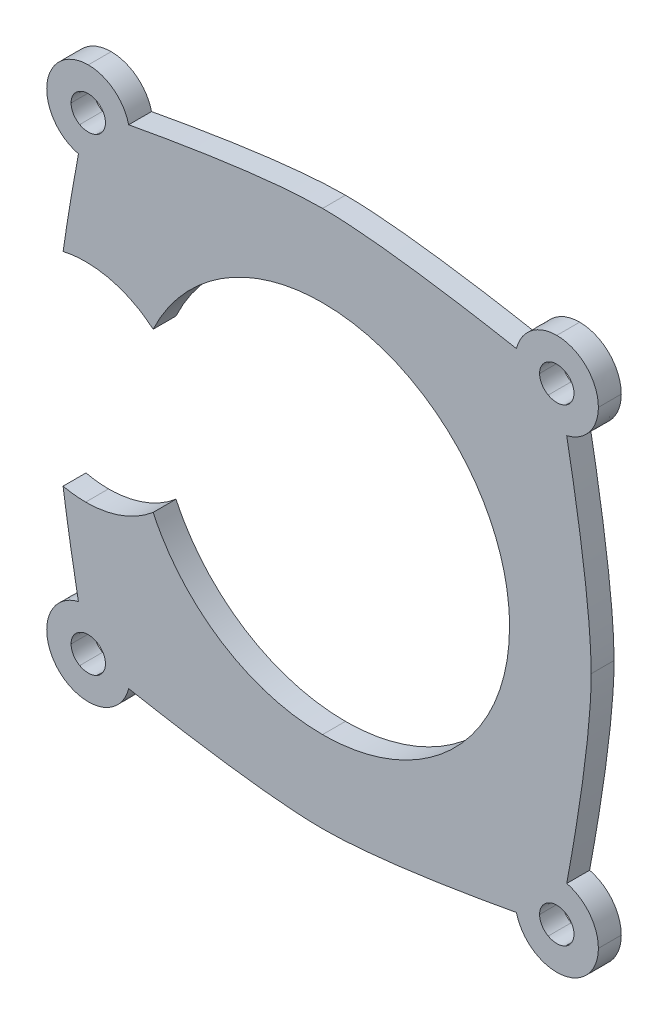
from build123d import *

# Parameters (mm, degrees)
BOSS_EXTRUDE1_DEPTH = 3.175


with BuildPart() as part:
    # Model → Boss-Extrude1 (new body)
    with BuildSketch(Plane.XY):
        with BuildLine():
            add(Edge.make_bspline(
                [(89.235139, 300.757083), (86.049911, 300.757083), (83.467222, 298.174394), (83.467222, 294.989167)],
                knots=[0, 0, 0, 0, 1, 1, 1, 1], degree=3))
            add(Edge.make_bspline(
                [(83.467222, 294.989167), (83.467222, 292.273816), (85.341175, 290.001546), (87.868125, 289.388819)],
                knots=[0, 0, 0, 0, 1, 1, 1, 1], degree=3))
            add(Edge.make_bspline(
                [(87.868125, 289.388819), (87.222025, 285.920316), (86.411723, 281.286853), (85.742639, 276.582986)],
                knots=[0, 0, 0, 0, 1, 1, 1, 1], degree=3))
            add(Edge.make_bspline(
                [(85.742639, 276.582986), (86.748437, 276.804637), (87.792309, 276.926944), (88.864722, 276.926944)],
                knots=[0, 0, 0, 0, 1, 1, 1, 1], degree=3))
            add(Edge.make_bspline(
                [(88.864722, 276.926944), (92.439544, 276.926944), (95.708761, 275.629099), (98.230972, 273.478542)],
                knots=[0, 0, 0, 0, 1, 1, 1, 1], degree=3))
            add(Edge.make_bspline(
                [(98.230972, 273.478542), (102.371652, 282.311181), (111.343573, 288.4275), (121.743611, 288.4275)],
                knots=[0, 0, 0, 0, 1, 1, 1, 1], degree=3))
            add(Edge.make_bspline(
                [(121.743611, 288.4275), (136.077139, 288.4275), (147.690417, 276.814222), (147.690417, 262.480694)],
                knots=[0, 0, 0, 0, 1, 1, 1, 1], degree=3))
            add(Edge.make_bspline(
                [(147.690417, 262.480694), (147.690417, 248.147167), (136.077139, 236.525069), (121.743611, 236.525069)],
                knots=[0, 0, 0, 0, 1, 1, 1, 1], degree=3))
            add(Edge.make_bspline(
                [(121.743611, 236.525069), (111.344812, 236.525069), (102.37231, 242.643086), (98.230972, 251.474028)],
                knots=[0, 0, 0, 0, 1, 1, 1, 1], degree=3))
            add(Edge.make_bspline(
                [(98.230972, 251.474028), (95.708964, 249.322287), (92.43883, 248.025625), (88.864722, 248.025625)],
                knots=[0, 0, 0, 0, 1, 1, 1, 1], degree=3))
            add(Edge.make_bspline(
                [(88.864722, 248.025625), (87.789151, 248.025625), (86.742346, 248.155481), (85.733819, 248.378403)],
                knots=[0, 0, 0, 0, 1, 1, 1, 1], degree=3))
            add(Edge.make_bspline(
                [(85.733819, 248.378403), (86.400877, 243.674314), (87.213598, 239.042116), (87.859306, 235.572569)],
                knots=[0, 0, 0, 0, 1, 1, 1, 1], degree=3))
            add(Edge.make_bspline(
                [(87.859306, 235.572569), (85.336253, 234.957079), (83.467222, 232.684807), (83.467222, 229.972222)],
                knots=[0, 0, 0, 0, 1, 1, 1, 1], degree=3))
            add(Edge.make_bspline(
                [(83.467222, 229.972222), (83.467222, 226.786994), (86.049911, 224.204306), (89.235139, 224.204306)],
                knots=[0, 0, 0, 0, 1, 1, 1, 1], degree=3))
            add(Edge.make_bspline(
                [(89.235139, 224.204306), (91.947723, 224.204306), (94.219996, 226.073336), (94.835486, 228.596389)],
                knots=[0, 0, 0, 0, 1, 1, 1, 1], degree=3))
            add(Edge.make_bspline(
                [(94.835486, 228.596389), (102.047579, 227.254168), (114.285418, 225.200903), (121.743611, 225.200903)],
                knots=[0, 0, 0, 0, 1, 1, 1, 1], degree=3))
            add(Edge.make_bspline(
                [(121.743611, 225.200903), (129.201807, 225.200903), (141.439643, 227.254168), (148.651736, 228.596389)],
                knots=[0, 0, 0, 0, 1, 1, 1, 1], degree=3))
            add(Edge.make_bspline(
                [(148.651736, 228.596389), (149.267387, 226.073565), (151.539662, 224.204306), (154.252083, 224.204306)],
                knots=[0, 0, 0, 0, 1, 1, 1, 1], degree=3))
            add(Edge.make_bspline(
                [(154.252083, 224.204306), (157.437311, 224.204306), (160.02, 226.786994), (160.02, 229.972222)],
                knots=[0, 0, 0, 0, 1, 1, 1, 1], degree=3))
            add(Edge.make_bspline(
                [(160.02, 229.972222), (160.02, 232.682524), (158.147752, 234.95481), (155.627917, 235.572569)],
                knots=[0, 0, 0, 0, 1, 1, 1, 1], degree=3))
            add(Edge.make_bspline(
                [(155.627917, 235.572569), (156.970137, 242.784662), (159.023403, 255.022498), (159.023403, 262.480694)],
                knots=[0, 0, 0, 0, 1, 1, 1, 1], degree=3))
            add(Edge.make_bspline(
                [(159.023403, 262.480694), (159.023403, 269.938892), (156.970137, 282.176727), (155.627917, 289.388819)],
                knots=[0, 0, 0, 0, 1, 1, 1, 1], degree=3))
            add(Edge.make_bspline(
                [(155.627917, 289.388819), (158.147557, 290.006717), (160.02, 292.279004), (160.02, 294.989167)],
                knots=[0, 0, 0, 0, 1, 1, 1, 1], degree=3))
            add(Edge.make_bspline(
                [(160.02, 294.989167), (160.02, 298.174394), (157.437311, 300.757083), (154.252083, 300.757083)],
                knots=[0, 0, 0, 0, 1, 1, 1, 1], degree=3))
            add(Edge.make_bspline(
                [(154.252083, 300.757083), (151.54192, 300.757083), (149.269633, 298.88464), (148.651736, 296.365)],
                knots=[0, 0, 0, 0, 1, 1, 1, 1], degree=3))
            add(Edge.make_bspline(
                [(148.651736, 296.365), (141.439643, 297.707221), (129.201807, 299.760486), (121.743611, 299.760486)],
                knots=[0, 0, 0, 0, 1, 1, 1, 1], degree=3))
            add(Edge.make_bspline(
                [(121.743611, 299.760486), (114.283927, 299.760486), (102.046284, 297.699256), (94.835486, 296.356181)],
                knots=[0, 0, 0, 0, 1, 1, 1, 1], degree=3))
            add(Edge.make_bspline(
                [(94.835486, 296.356181), (94.220769, 298.880322), (91.948497, 300.757083), (89.235139, 300.757083)],
                knots=[0, 0, 0, 0, 1, 1, 1, 1], degree=3))
        make_face()
        with BuildLine():
            add(Edge.make_bspline(
                [(91.616639, 294.986695), (91.616639, 294.161861), (91.16191, 293.399682), (90.423743, 292.987264)],
                knots=[0, 0, 0, 0, 1, 1, 1, 1], degree=3))
            add(Edge.make_bspline(
                [(90.423743, 292.987264), (89.685577, 292.574847), (88.776119, 292.574847), (88.037952, 292.987264)],
                knots=[0, 0, 0, 0, 1, 1, 1, 1], degree=3))
            add(Edge.make_bspline(
                [(88.037952, 292.987264), (87.299786, 293.399682), (86.845057, 294.161861), (86.845057, 294.986695)],
                knots=[0, 0, 0, 0, 1, 1, 1, 1], degree=3))
            add(Edge.make_bspline(
                [(86.845057, 294.986695), (86.845057, 295.81153), (87.299786, 296.573709), (88.037952, 296.986127)],
                knots=[0, 0, 0, 0, 1, 1, 1, 1], degree=3))
            add(Edge.make_bspline(
                [(88.037952, 296.986127), (88.776119, 297.398544), (89.685577, 297.398544), (90.423743, 296.986127)],
                knots=[0, 0, 0, 0, 1, 1, 1, 1], degree=3))
            add(Edge.make_bspline(
                [(90.423743, 296.986127), (91.16191, 296.573709), (91.616639, 295.81153), (91.616639, 294.986695)],
                knots=[0, 0, 0, 0, 1, 1, 1, 1], degree=3))
        make_face(mode=Mode.SUBTRACT)
        with BuildLine():
            add(Edge.make_bspline(
                [(156.635152, 229.968178), (156.635152, 229.143343), (156.180423, 228.381165), (155.442257, 227.968747)],
                knots=[0, 0, 0, 0, 1, 1, 1, 1], degree=3))
            add(Edge.make_bspline(
                [(155.442257, 227.968747), (154.704091, 227.55633), (153.794632, 227.55633), (153.056466, 227.968747)],
                knots=[0, 0, 0, 0, 1, 1, 1, 1], degree=3))
            add(Edge.make_bspline(
                [(153.056466, 227.968747), (152.3183, 228.381165), (151.863571, 229.143343), (151.863571, 229.968178)],
                knots=[0, 0, 0, 0, 1, 1, 1, 1], degree=3))
            add(Edge.make_bspline(
                [(151.863571, 229.968178), (151.863571, 230.793013), (152.3183, 231.555192), (153.056466, 231.967609)],
                knots=[0, 0, 0, 0, 1, 1, 1, 1], degree=3))
            add(Edge.make_bspline(
                [(153.056466, 231.967609), (153.794632, 232.380027), (154.704091, 232.380027), (155.442257, 231.967609)],
                knots=[0, 0, 0, 0, 1, 1, 1, 1], degree=3))
            add(Edge.make_bspline(
                [(155.442257, 231.967609), (156.180423, 231.555192), (156.635152, 230.793013), (156.635152, 229.968178)],
                knots=[0, 0, 0, 0, 1, 1, 1, 1], degree=3))
        make_face(mode=Mode.SUBTRACT)
        with BuildLine():
            add(Edge.make_bspline(
                [(91.616639, 229.968178), (91.616639, 229.143343), (91.16191, 228.381165), (90.423743, 227.968747)],
                knots=[0, 0, 0, 0, 1, 1, 1, 1], degree=3))
            add(Edge.make_bspline(
                [(90.423743, 227.968747), (89.685577, 227.55633), (88.776119, 227.55633), (88.037952, 227.968747)],
                knots=[0, 0, 0, 0, 1, 1, 1, 1], degree=3))
            add(Edge.make_bspline(
                [(88.037952, 227.968747), (87.299786, 228.381165), (86.845057, 229.143343), (86.845057, 229.968178)],
                knots=[0, 0, 0, 0, 1, 1, 1, 1], degree=3))
            add(Edge.make_bspline(
                [(86.845057, 229.968178), (86.845057, 230.793013), (87.299786, 231.555192), (88.037952, 231.967609)],
                knots=[0, 0, 0, 0, 1, 1, 1, 1], degree=3))
            add(Edge.make_bspline(
                [(88.037952, 231.967609), (88.776119, 232.380027), (89.685577, 232.380027), (90.423743, 231.967609)],
                knots=[0, 0, 0, 0, 1, 1, 1, 1], degree=3))
            add(Edge.make_bspline(
                [(90.423743, 231.967609), (91.16191, 231.555192), (91.616639, 230.793013), (91.616639, 229.968178)],
                knots=[0, 0, 0, 0, 1, 1, 1, 1], degree=3))
        make_face(mode=Mode.SUBTRACT)
        with BuildLine():
            add(Edge.make_bspline(
                [(156.635152, 294.986693), (156.635152, 294.161858), (156.180423, 293.399679), (155.442257, 292.987262)],
                knots=[0, 0, 0, 0, 1, 1, 1, 1], degree=3))
            add(Edge.make_bspline(
                [(155.442257, 292.987262), (154.704091, 292.574844), (153.794632, 292.574844), (153.056466, 292.987262)],
                knots=[0, 0, 0, 0, 1, 1, 1, 1], degree=3))
            add(Edge.make_bspline(
                [(153.056466, 292.987262), (152.3183, 293.399679), (151.863571, 294.161858), (151.863571, 294.986693)],
                knots=[0, 0, 0, 0, 1, 1, 1, 1], degree=3))
            add(Edge.make_bspline(
                [(151.863571, 294.986693), (151.863571, 295.811528), (152.3183, 296.573706), (153.056466, 296.986124)],
                knots=[0, 0, 0, 0, 1, 1, 1, 1], degree=3))
            add(Edge.make_bspline(
                [(153.056466, 296.986124), (153.794632, 297.398541), (154.704091, 297.398541), (155.442257, 296.986124)],
                knots=[0, 0, 0, 0, 1, 1, 1, 1], degree=3))
            add(Edge.make_bspline(
                [(155.442257, 296.986124), (156.180423, 296.573706), (156.635152, 295.811528), (156.635152, 294.986693)],
                knots=[0, 0, 0, 0, 1, 1, 1, 1], degree=3))
        make_face(mode=Mode.SUBTRACT)
    extrude(amount=BOSS_EXTRUDE1_DEPTH)


solid = part.part
